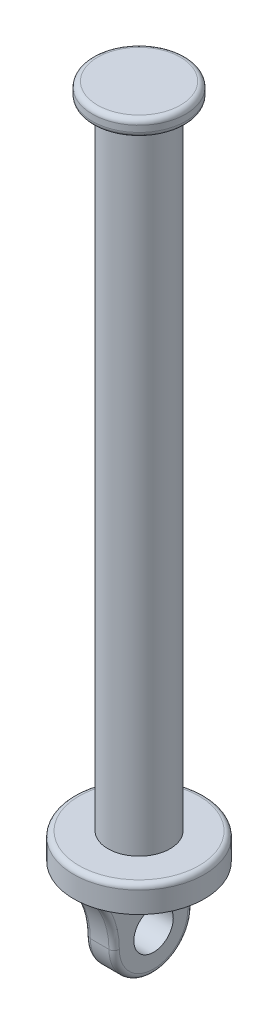
from build123d import *

# Parameters (mm, degrees)
SKETCH1_R           = 15
BOSS_EXTRUDE1_DEPTH = 305
SKETCH2_R           = 22.5
BOSS_EXTRUDE2_DEPTH = 8
SKETCH3_R           = 31.5
BOSS_EXTRUDE3_DEPTH = 12.7
SKETCH4_R           = 9.5
BOSS_EXTRUDE5_DEPTH = 7
FILLET1_R           = 2.5


with BuildPart() as part:
    # Sketch1 → Boss-Extrude1 (new body)
    with BuildSketch(Plane(origin=(0, 0, 0), x_dir=(1, 0, 0), z_dir=(0, 1, 0))):
        with Locations(Location((0, 0, 0), (0, 0, 270))):
            Circle(SKETCH1_R)
    extrude(amount=BOSS_EXTRUDE1_DEPTH)

    # Sketch2 → Boss-Extrude2 (add)
    with BuildSketch(Plane(origin=(0, 305, 0), x_dir=(1, 0, 0), z_dir=(0, 1, 0))):
        with Locations(Location((0, 0, 0), (0, 0, 270))):
            Circle(SKETCH2_R)
    extrude(amount=BOSS_EXTRUDE2_DEPTH)

    # Sketch3 → Boss-Extrude3 (add)
    with BuildSketch(Plane.XZ):
        with Locations(Location((0, 0, 0), (0, 0, 270))):
            Circle(SKETCH3_R)
    extrude(amount=BOSS_EXTRUDE3_DEPTH)

    # Sketch4 → Boss-Extrude5 (add, symmetric)
    with BuildSketch(Plane(origin=(0, 0, 0), x_dir=(0, 0, -1), z_dir=(1, 0, 0))):
        with BuildLine():
            Line((-28.5, -12.7), (28.5, -12.7))
            ThreePointArc((28.5, -12.7), (21.470051482, -24.357649102), (18.999946854, -37.744939413))
            ThreePointArc((18.999946854, -37.744939413), (0, -56.7), (-18.999946854, -37.744939413))
            ThreePointArc((-18.999946854, -37.744939413), (-21.470051482, -24.357649102), (-28.5, -12.7))
        make_face()
        with Locations((0, -37.7)):
            Circle(SKETCH4_R, mode=Mode.SUBTRACT)
    extrude(amount=BOSS_EXTRUDE5_DEPTH, both=True)

    # Fillet1
    fillet1_edges = [part.edges().sort_by_distance(p)[0] for p in [
        (0, 0, 31.5),
        (7, -24.357649102, -21.470051482),
        (7, -24.357649102, 21.470051482),
        (7, -56.7, 0),
        (-7, -24.357649102, -21.470051482),
        (-7, -24.357649102, 21.470051482),
        (-7, -56.7, 0),
        (0, 305, -22.5),
        (0, 313, -22.5),
    ]]
    fillet(fillet1_edges, radius=FILLET1_R)


solid = part.part
